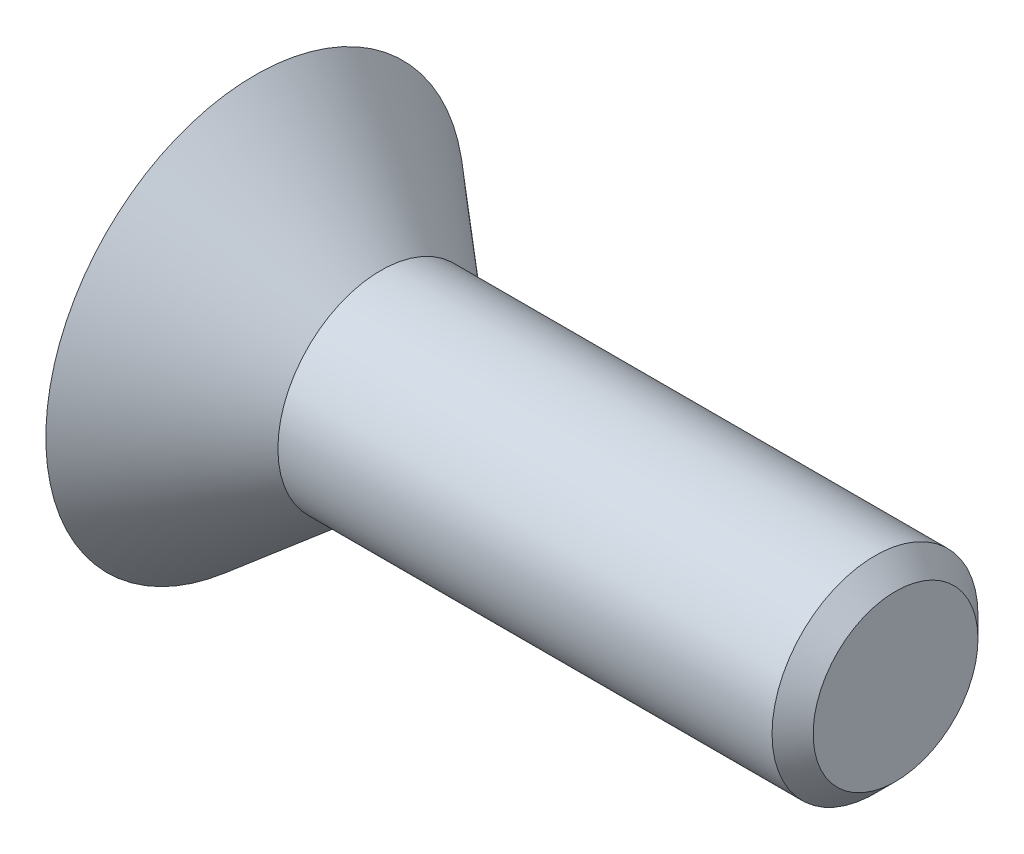
from build123d import *

# Parameters (mm, degrees)
CUT_EXTRUDE1_DEPTH = 2


with BuildPart() as part:
    # Sketch1 → Revolve1 (revolve)
    with BuildSketch(Plane.XY):
        Polygon((522.668754, 269.497429), (523.461488, 268.705203), (523.461488, 265.527536), (498.7671, 265.527536), (498.7671, 273.592163), (503.618754, 269.497429), align=None)
    revolve(axis=Axis((523.461488, 265.527536, 0), (-1, 0, 0)))

    # Sketch2 → Cut-Extrude1 (cut)
    with BuildSketch(Plane.ZY.offset(-498.7671)):
        Polygon((-1, 266.527536), (-6, 266.527536), (-6, 264.527536), (-1, 264.527536), (-1, 259.527536), (1, 259.527536), (1, 264.527536), (6, 264.527536), (6, 266.527536), (1, 266.527536), (1, 271.527536), (-1, 271.527536), align=None)
    extrude(amount=-CUT_EXTRUDE1_DEPTH, mode=Mode.SUBTRACT)


solid = part.part
